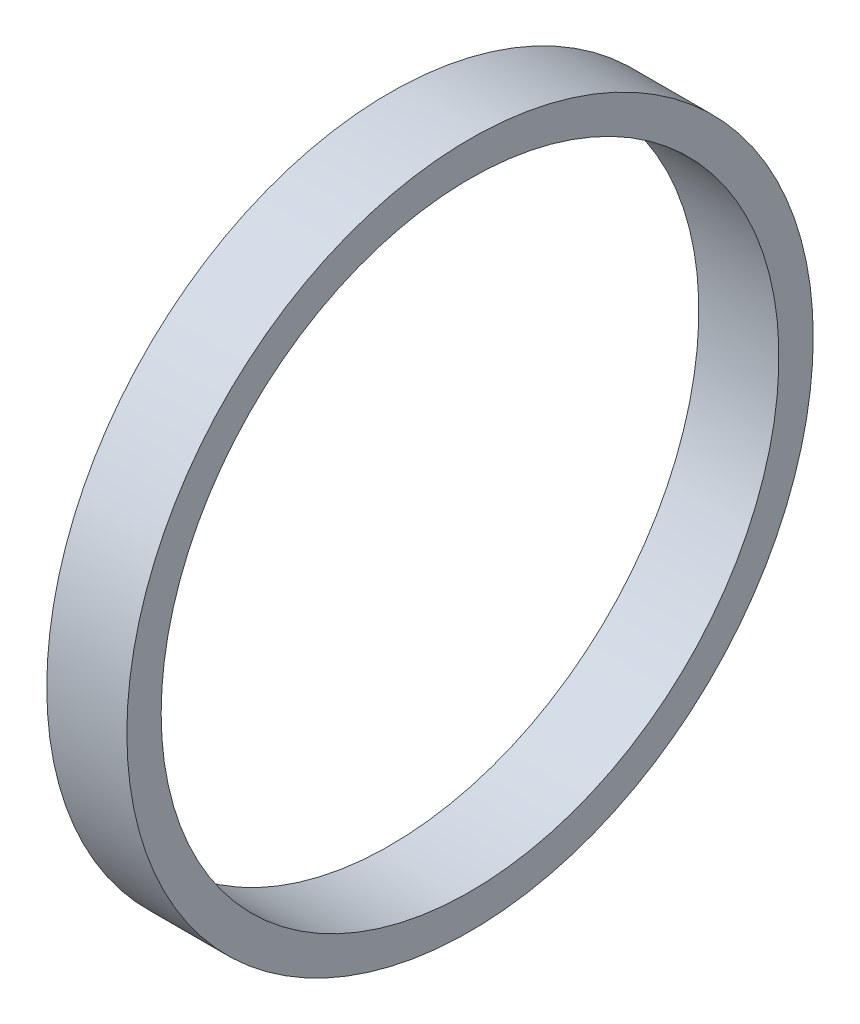
from build123d import *

# Parameters (mm, degrees)
ESQUISSE1_W = 7
ESQUISSE1_H = 3


with BuildPart() as part:
    # Esquisse1 → Révolution1 (revolve)
    with BuildSketch(Plane.XY, mode=Mode.PRIVATE) as r_volution1_sk:
        with Locations((3.5, 28.5)):
            Rectangle(ESQUISSE1_W, ESQUISSE1_H)
    revolve(r_volution1_sk.sketch.rotate(Axis((0, 0, 0), (1, 0, 0)), 90), axis=Axis((0, 0, 0), (1, 0, 0)))


solid = part.part
